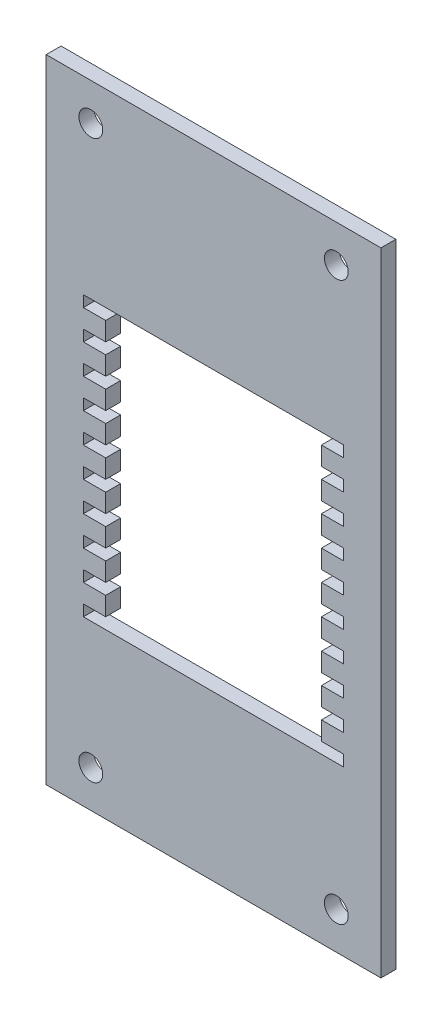
from build123d import *

# Parameters (mm, degrees)
SKIZZE1_W                       = 45
SKIZZE1_H                       = 85
AUFSATZ_LINEAR_AUSTRAGEN1_DEPTH = 2
SKIZZE6_R                       = 1.6
SCHNITT_LINEAR_AUSTRAGEN2_DEPTH = 2
SKIZZE7_W                       = 35
SKIZZE7_H                       = 1.5
SCHNITT_LINEAR_AUSTRAGEN3_DEPTH = 10
SKIZZE8_W                       = 29
SKIZZE8_H                       = 37.5
SCHNITT_LINEAR_AUSTRAGEN4_DEPTH = 10


with BuildPart() as part:
    # Skizze1 → Aufsatz-Linear austragen1 (new body)
    with BuildSketch(Plane.XY):
        with Locations((22.5, 42.5)):
            Rectangle(SKIZZE1_W, SKIZZE1_H)
    extrude(amount=AUFSATZ_LINEAR_AUSTRAGEN1_DEPTH)

    # Skizze6 → Schnitt-Linear austragen2 (cut)
    with BuildSketch(Plane.XY.offset(2)):
        with Locations((6, 80)):
            Circle(SKIZZE6_R)
        with Locations((39, 80)):
            Circle(SKIZZE6_R)
        with Locations((39, 5)):
            Circle(SKIZZE6_R)
        with Locations((6, 5)):
            Circle(SKIZZE6_R)
    extrude(amount=-SCHNITT_LINEAR_AUSTRAGEN2_DEPTH, mode=Mode.SUBTRACT)

    # Skizze7 → Schnitt-Linear austragen3 (cut)
    with BuildSketch(Plane.XY.offset(2)):
        with Locations((22.5, 58.8)):
            Rectangle(SKIZZE7_W, SKIZZE7_H)
        with Locations((22.5, 54.8)):
            Rectangle(SKIZZE7_W, SKIZZE7_H)
        with Locations((22.5, 50.8)):
            Rectangle(SKIZZE7_W, SKIZZE7_H)
        with Locations((22.5, 46.8)):
            Rectangle(SKIZZE7_W, SKIZZE7_H)
        with Locations((22.5, 42.8)):
            Rectangle(SKIZZE7_W, SKIZZE7_H)
        with Locations((22.5, 38.8)):
            Rectangle(SKIZZE7_W, SKIZZE7_H)
        with Locations((22.5, 34.8)):
            Rectangle(SKIZZE7_W, SKIZZE7_H)
        with Locations((22.5, 30.8)):
            Rectangle(SKIZZE7_W, SKIZZE7_H)
        with Locations((22.5, 26.8)):
            Rectangle(SKIZZE7_W, SKIZZE7_H)
        with Locations((22.5, 22.8)):
            Rectangle(SKIZZE7_W, SKIZZE7_H)
    extrude(amount=-SCHNITT_LINEAR_AUSTRAGEN3_DEPTH, mode=Mode.SUBTRACT)

    # Skizze8 → Schnitt-Linear austragen4 (cut)
    with BuildSketch(Plane.XY.offset(2)):
        with Locations((22.5, 40.8)):
            Rectangle(SKIZZE8_W, SKIZZE8_H)
    extrude(amount=-SCHNITT_LINEAR_AUSTRAGEN4_DEPTH, mode=Mode.SUBTRACT)


solid = part.part
